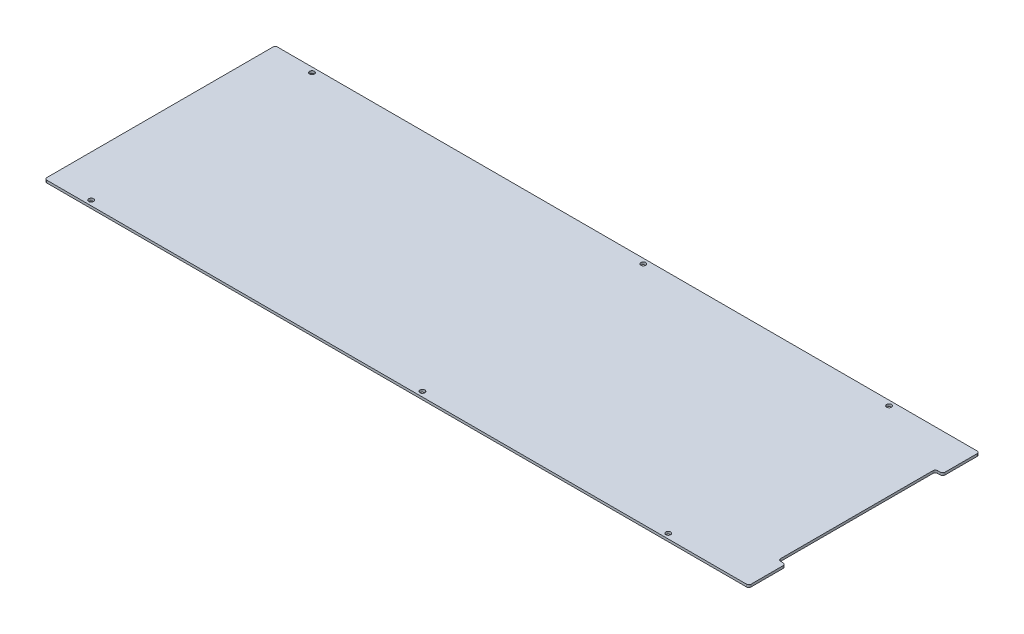
from build123d import *

# Parameters (mm, degrees)
SKETCH1_W                   = 911.225
SKETCH1_H                   = 298.45
BOSS_EXTRUDE1_DEPTH         = 3.175
SKETCH2_W                   = 9.525
SKETCH2_H                   = 203.2
CUT_EXTRUDE1_DEPTH          = 480.438141376
FILLET1_R                   = 3.175
F_1_4_0_25_DIAMETER_HOLE1_D = 6.35
FILLET2_R                   = 3.175


with BuildPart() as part:
    # Sketch1 → Boss-Extrude1 (new body)
    with BuildSketch(Plane(origin=(0, 0, 0), x_dir=(1, 0, 0), z_dir=(0, 1, 0))):
        Rectangle(SKETCH1_W, SKETCH1_H)
    extrude(amount=BOSS_EXTRUDE1_DEPTH)

    # Sketch2 → Cut-Extrude1 (cut, through all)
    with BuildSketch(Plane(origin=(0, 3.175, 0), x_dir=(1, 0, 0), z_dir=(0, 1, 0))):
        with Locations((450.85, 0)):
            Rectangle(SKETCH2_W, SKETCH2_H)
    extrude(amount=-CUT_EXTRUDE1_DEPTH, mode=Mode.SUBTRACT)

    # Fillet1
    fillet1_edges = [part.edges().sort_by_distance(p)[0] for p in [
        (446.0875, 1.5875, 101.6),
        (446.0875, 1.5875, -101.6),
    ]]
    fillet(fillet1_edges, radius=FILLET1_R)

    # 1/4 (0.25) Diameter Hole1 (through all)
    with Locations(Plane(origin=(0, 0, 0), x_dir=(-1, 0, 0), z_dir=(0, -1, 0))):
        with Locations((-345.04884, 142.875), (401.6375, 142.875), (-26.9875, 142.875)):
            f_1_4_0_25_diameter_hole1 = Hole(F_1_4_0_25_DIAMETER_HOLE1_D / 2)

    # Mirror1: 1/4 (0.25) Diameter Hole1 across plane
    add(f_1_4_0_25_diameter_hole1.mirror(Plane.XY), mode=Mode.SUBTRACT)

    # Fillet2
    fillet2_edges = [part.edges().sort_by_distance(p)[0] for p in [
        (455.6125, 1.5875, -101.6),
        (455.6125, 1.5875, 101.6),
        (455.6125, 1.5875, 149.225),
        (-455.6125, 1.5875, 149.225),
        (-455.6125, 1.5875, -149.225),
        (455.6125, 1.5875, -149.225),
    ]]
    fillet(fillet2_edges, radius=FILLET2_R)


solid = part.part
